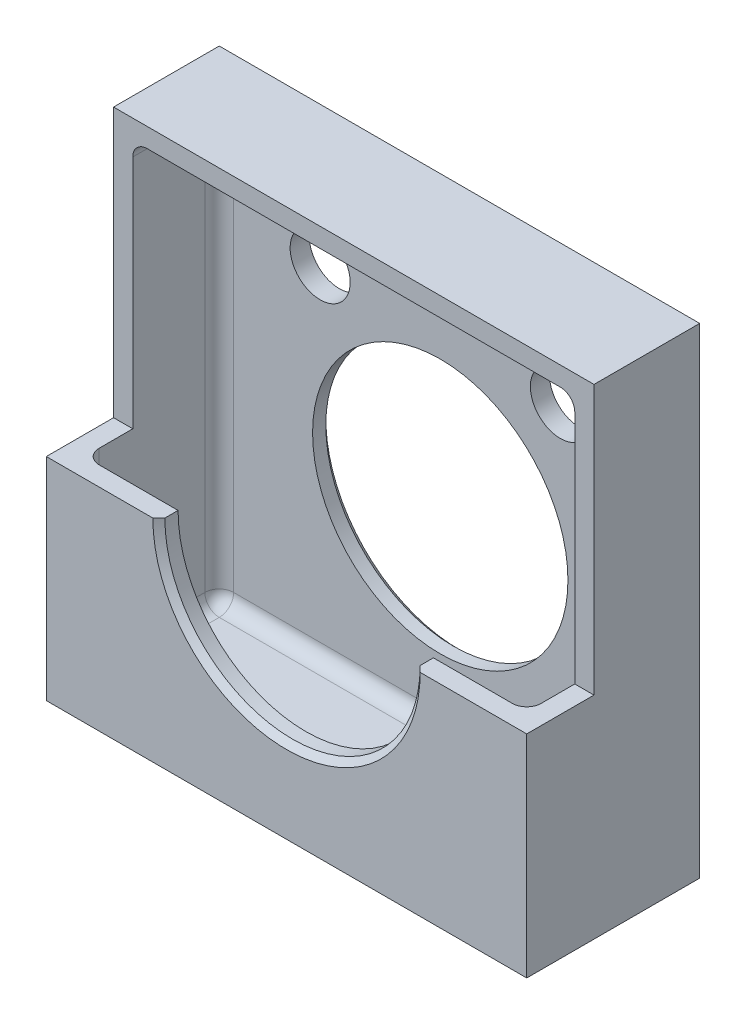
from build123d import *

# Parameters (mm, degrees)
SKETCH1_W          = 50.8
SKETCH1_H          = 50.8
MAIN_BODY_DEPTH    = 18.288
SKETCH2_W          = 7.112
SKETCH2_H          = 28.448
FRONT_CUT_DEPTH    = 75.133197314
SHELL1_T           = -2.032
SKETCH3_R          = 13.5001
CENTER_HOLE_DEPTH  = 75.133197314
FILL060_VERT_R     = 1.524
FILL060_TB_R       = 1.524
CHAM025_SIZE       = 0.635
KEYED_HOLE_1_DEPTH = 58.653742931


with BuildPart() as part:
    # Sketch1 → main body (new body)
    with BuildSketch(Plane.XY):
        with Locations((25.4, 25.4)):
            Rectangle(SKETCH1_W, SKETCH1_H)
    extrude(amount=MAIN_BODY_DEPTH)

    # Sketch2 → front cut (cut, through all)
    with BuildSketch(Plane(origin=(50.8, 0, 0), x_dir=(0, 0, -1), z_dir=(1, 0, 0))):
        with Locations((-14.732, 36.576)):
            Rectangle(SKETCH2_W, SKETCH2_H)
    extrude(amount=-FRONT_CUT_DEPTH, mode=Mode.SUBTRACT)

    # Shell1
    shell1_openings = [part.faces().sort_by_distance(p)[0] for p in [
        (25.4, 36.576, 11.176),
        (25.4, 22.352, 14.732),
    ]]
    offset(amount=SHELL1_T, openings=shell1_openings, kind=Kind.INTERSECTION)

    # Sketch3 → center hole (cut, through all)
    with BuildSketch(Plane.XY):
        with Locations((25.4, 22.352)):
            Circle(SKETCH3_R)
    extrude(amount=CENTER_HOLE_DEPTH, mode=Mode.SUBTRACT)

    # fill060.vert
    fill060_vert_edges = [part.edges().sort_by_distance(p)[0] for p in [
        (2.032, 12.192, 16.256),
        (48.768, 12.192, 16.256),
        (2.032, 25.4, 2.032),
        (48.768, 25.4, 2.032),
    ]]
    fillet(fill060_vert_edges, radius=FILL060_VERT_R)

    # fill060.tb
    fill060_tb_edges = [part.edges().sort_by_distance(p)[0] for p in [
        (2.032, 48.768, 7.366),
        (48.768, 48.768, 7.366),
        (25.4, 2.032, 16.256),
        (25.4, 2.032, 2.032),
        (2.032, 2.032, 9.144),
        (48.768, 2.032, 9.144),
        (2.478369265, 2.032, 15.809630735),
        (2.478369265, 2.032, 2.478369265),
        (48.321630735, 2.032, 2.478369265),
        (48.321630735, 2.032, 15.809630735),
        (25.4, 48.768, 2.032),
        (2.478369265, 48.768, 2.478369265),
        (48.321630735, 48.768, 2.478369265),
    ]]
    fillet(fill060_tb_edges, radius=FILL060_TB_R)

    # cham025
    cham025_edges = [part.edges().sort_by_distance(p)[0] for p in [
        (11.8999, 22.352, 0),
        (25.4, 8.8519, 18.288),
    ]]
    chamfer(cham025_edges, length=CHAM025_SIZE)

    # Sketch6 → Keyed Hole 1 (cut, through all)
    with BuildSketch(Plane(origin=(13.426773448, 39.909210303, 0), x_dir=(0, 1, 0), z_dir=(0, 0, -1))):
        with BuildLine():
            Line((1.238789697, 0.162226552), (2.635789697, 0.162226552))
            Line((2.635789697, 0.162226552), (2.635789697, -1.615773448))
            Line((2.635789697, -1.615773448), (1.238789697, -1.615773448))
            ThreePointArc((1.238789697, -1.615773448), (-4.984210303, -0.726773448), (1.238789697, 0.162226552))
        make_face()
    keyed_hole_1 = extrude(amount=-KEYED_HOLE_1_DEPTH, mode=Mode.SUBTRACT)

    # Mirror1: Keyed Hole 1 across plane
    add(keyed_hole_1.mirror(Plane.ZY.offset(-25.4)), mode=Mode.SUBTRACT)


solid = part.part
